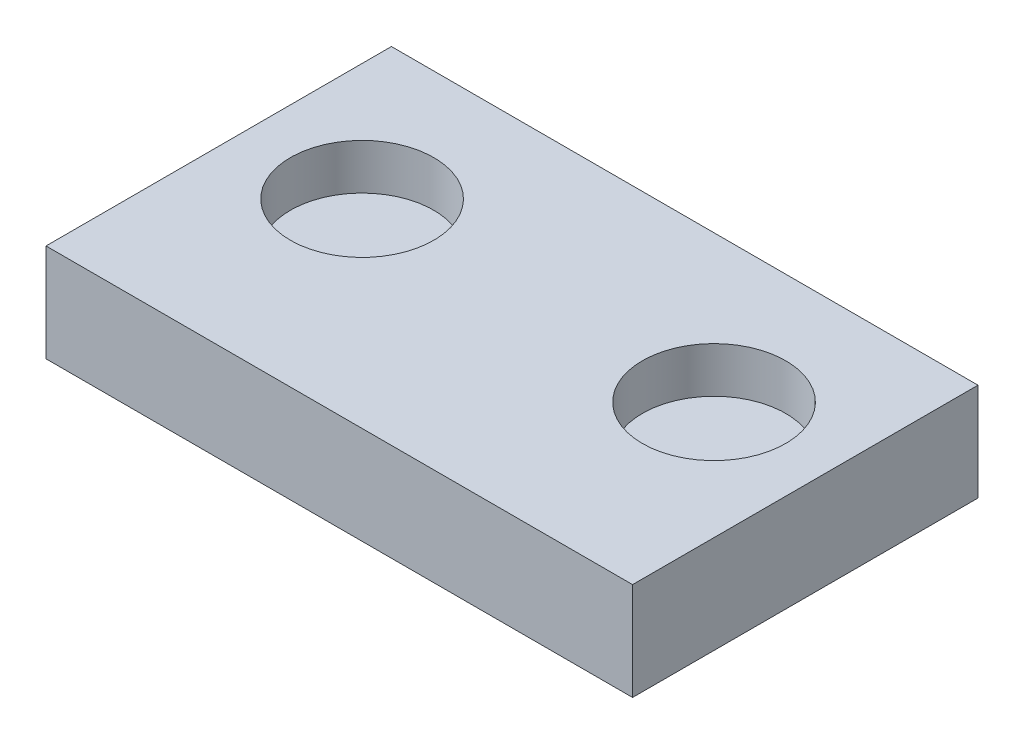
from build123d import *

# Parameters (mm, degrees)
CROQUIS1_W              = 90
CROQUIS1_H              = 53
SALIENTE_EXTRUIR1_DEPTH = 15
CROQUIS2_R              = 11
CORTAR_EXTRUIR1_DEPTH   = 7


with BuildPart() as part:
    # Croquis1 → Saliente-Extruir1 (new body)
    with BuildSketch(Plane(origin=(0, 0, 0), x_dir=(1, 0, 0), z_dir=(0, 1, 0))):
        with Locations((45, 26.5)):
            Rectangle(CROQUIS1_W, CROQUIS1_H)
    extrude(amount=SALIENTE_EXTRUIR1_DEPTH)

    # Croquis2 → Cortar-Extruir1 (cut)
    with BuildSketch(Plane(origin=(0, 15, 0), x_dir=(1, 0, 0), z_dir=(0, 1, 0))):
        with Locations(Location((18, 30.5, 0), (0, 0, 270))):
            Circle(CROQUIS2_R)
        with Locations(Location((72, 30.5, 0), (0, 0, 270))):
            Circle(CROQUIS2_R)
    extrude(amount=-CORTAR_EXTRUIR1_DEPTH, mode=Mode.SUBTRACT)


solid = part.part
